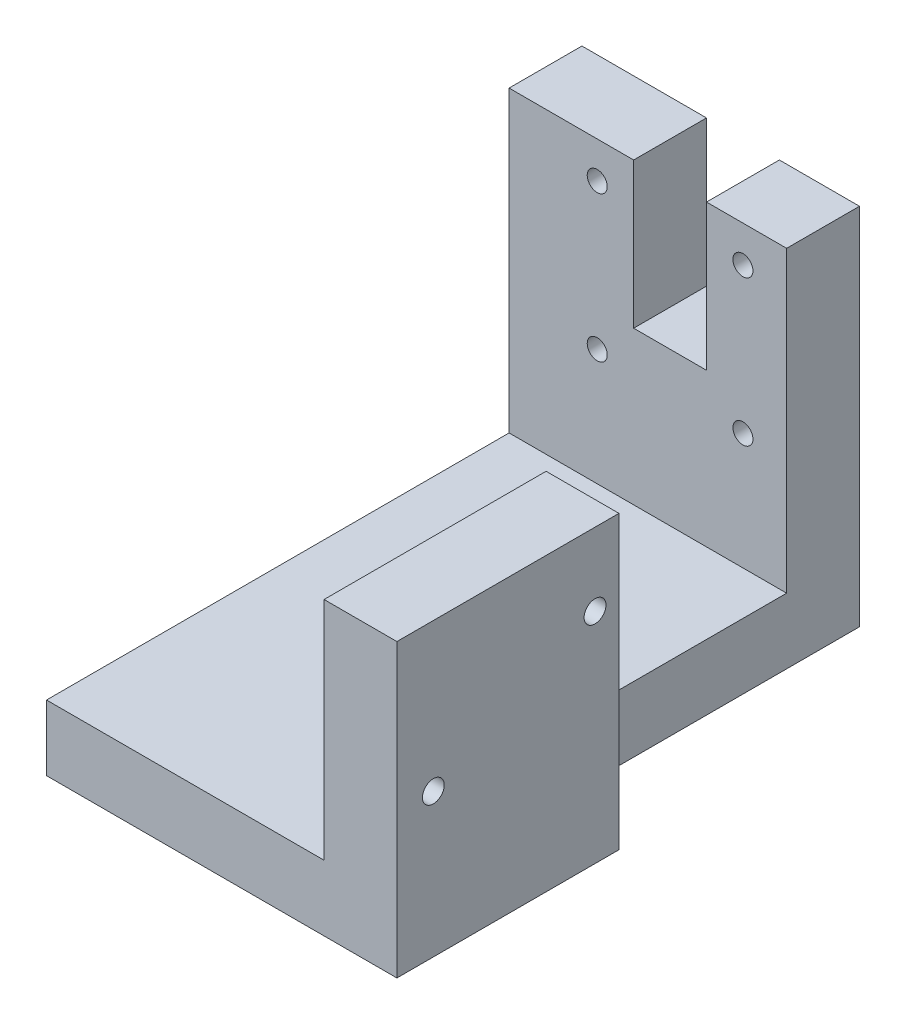
from build123d import *

# Parameters (mm, degrees)
SKETCH1_R           = 4.064
BOSS_EXTRUDE1_DEPTH = 9
SKETCH1_3_W         = 10
SKETCH1_3_H         = 30.48
BOSS_EXTRUDE2_DEPTH = 40
SKETCH2_R           = 1.5
CUT_EXTRUDE1_DEPTH  = 10
SKETCH3_R           = 1.375
BOSS_EXTRUDE3_DEPTH = 10


with BuildPart() as part:
    # Sketch1 → Boss-Extrude1 (new body)
    with BuildSketch(Plane(origin=(0, 0, 0), x_dir=(1, 0, 0), z_dir=(0, 1, 0))):
        Polygon((19.05, -31.75), (19.05, -1.27), (19.05, 31.75), (-19.05, 31.75), (-19.05, -31.75), align=None)
        with Locations((0, -6.35)):
            Circle(SKETCH1_R, mode=Mode.SUBTRACT)
    extrude(amount=BOSS_EXTRUDE1_DEPTH)

    # Sketch1<3> → Boss-Extrude2 (add)
    with BuildSketch(Plane(origin=(0, 0, 0), x_dir=(1, 0, 0), z_dir=(0, 1, 0))):
        with Locations((24.05, -16.51)):
            Rectangle(SKETCH1_3_W, SKETCH1_3_H)
    extrude(amount=BOSS_EXTRUDE2_DEPTH)

    # Sketch2 → Cut-Extrude1 (cut)
    with BuildSketch(Plane(origin=(29.05, 0, 0), x_dir=(0, 0, -1), z_dir=(1, 0, 0))):
        with Locations((-26.75, 19.7)):
            Circle(SKETCH2_R)
        with Locations((-4.55, 30)):
            Circle(SKETCH2_R)
    extrude(amount=-CUT_EXTRUDE1_DEPTH, mode=Mode.SUBTRACT)

    # Sketch3 → Boss-Extrude3 (add)
    with BuildSketch(Plane(origin=(0, 0, -31.75), x_dir=(-1, 0, 0), z_dir=(0, 0, -1))):
        Polygon((-19.05, 0), (19.05, 0), (19.05, 50), (1.95, 50), (1.95, 30), (-8.05, 30), (-8.05, 50), (-19.05, 50), align=None)
        with Locations((-13.05, 25)):
            Circle(SKETCH3_R, mode=Mode.SUBTRACT)
        with Locations((6.95, 25)):
            Circle(SKETCH3_R, mode=Mode.SUBTRACT)
        with Locations((-13.05, 45)):
            Circle(SKETCH3_R, mode=Mode.SUBTRACT)
        with Locations((6.95, 45)):
            Circle(SKETCH3_R, mode=Mode.SUBTRACT)
    extrude(amount=BOSS_EXTRUDE3_DEPTH)


solid = part.part
